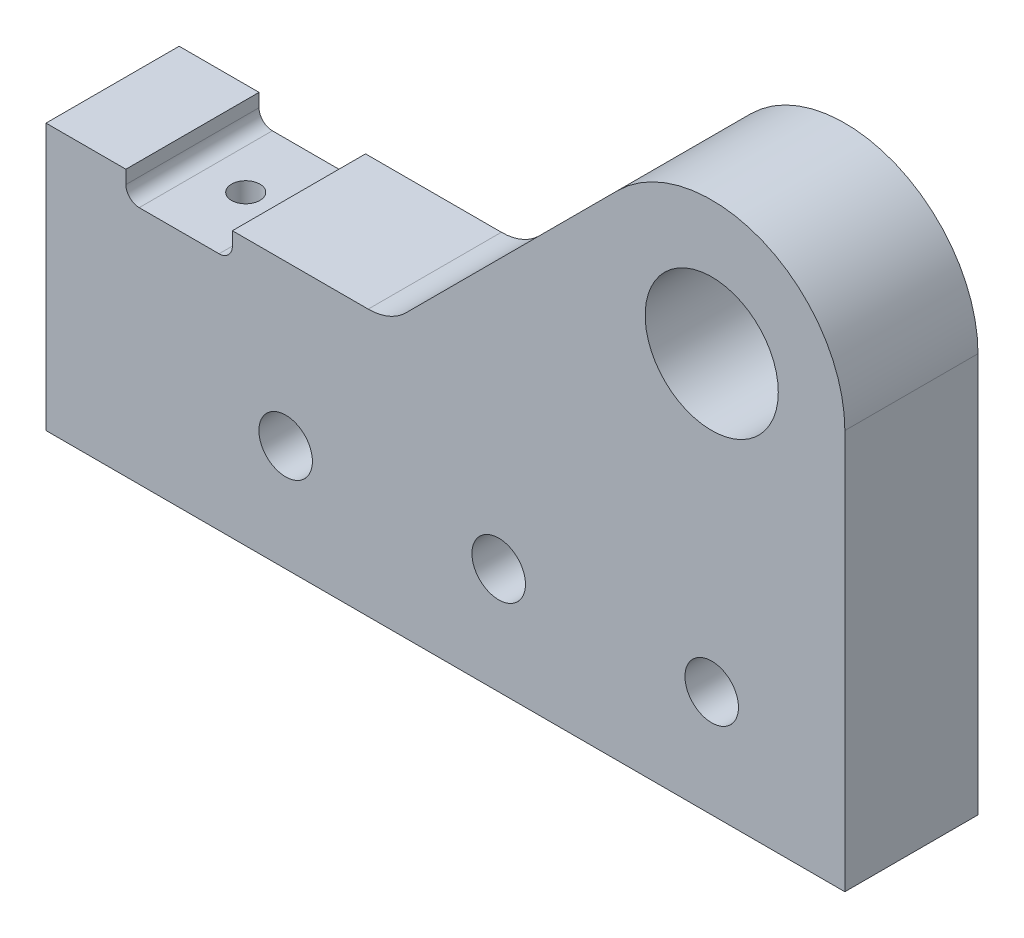
from build123d import *

# Parameters (mm, degrees)
SKETCH1_R                 = 6.35
BOSS_EXTRUDE1_DEPTH       = 12.7
F_1_4_20_TAPPED_HOLE1_D   = 5.1054
F_6_32_TAPPED_HOLE1_D     = 2.7051
F_6_32_TAPPED_HOLE1_DEPTH = 9.398
F_6_32_TAPPED_HOLE1_TIP   = 0.81269403


with BuildPart() as part:
    # Sketch1 → Boss-Extrude1 (new body)
    with BuildSketch(Plane.XY):
        with BuildLine():
            Line((38.1, 12.7), (38.1, 25.4))
            ThreePointArc((38.1, 25.4), (30.260079591, 37.133270063), (16.419743879, 34.380256121))
            Line((16.419743879, 34.380256121), (-3.772614691, 14.187897552))
            ThreePointArc((-3.772614691, 14.187897552), (-5.420685303, 13.086691975), (-7.364717139, 12.7))
            Line((-7.364717139, 12.7), (-20.32, 12.7))
            Line((-20.32, 12.7), (-20.32, 11.43))
            ThreePointArc((-20.32, 11.43), (-20.691974388, 10.531974388), (-21.59, 10.16))
            Line((-21.59, 10.16), (-29.21, 10.16))
            ThreePointArc((-29.21, 10.16), (-30.108025612, 10.531974388), (-30.48, 11.43))
            Line((-30.48, 11.43), (-30.48, 12.7))
            Line((-30.48, 12.7), (-38.1, 12.7))
            Line((-38.1, 12.7), (-38.1, -12.7))
            Line((-38.1, -12.7), (38.1, -12.7))
            Line((38.1, -12.7), (38.1, 12.7))
        make_face()
        with Locations((25.4, 25.4)):
            Circle(SKETCH1_R, mode=Mode.SUBTRACT)
    extrude(amount=BOSS_EXTRUDE1_DEPTH)

    # 1/4-20 Tapped Hole1 (through all)
    with Locations(Plane.XY.offset(12.7)):
        with Locations((-15.24, -2.54), (5.08, -2.54), (25.4, -2.54)):
            Hole(F_1_4_20_TAPPED_HOLE1_D / 2)

    # #6-32 Tapped Hole1
    with Locations(Plane(origin=(0, 10.16, 0), x_dir=(1, 0, 0), z_dir=(0, 1, 0))):
        with Locations((-25.4, -6.35)):
            Hole(F_6_32_TAPPED_HOLE1_D / 2, depth=F_6_32_TAPPED_HOLE1_DEPTH)
            with Locations((0, 0, -(F_6_32_TAPPED_HOLE1_DEPTH + F_6_32_TAPPED_HOLE1_TIP / 2))):  # 118° drill point
                Cone(0, F_6_32_TAPPED_HOLE1_D / 2, F_6_32_TAPPED_HOLE1_TIP, mode=Mode.SUBTRACT)


solid = part.part
